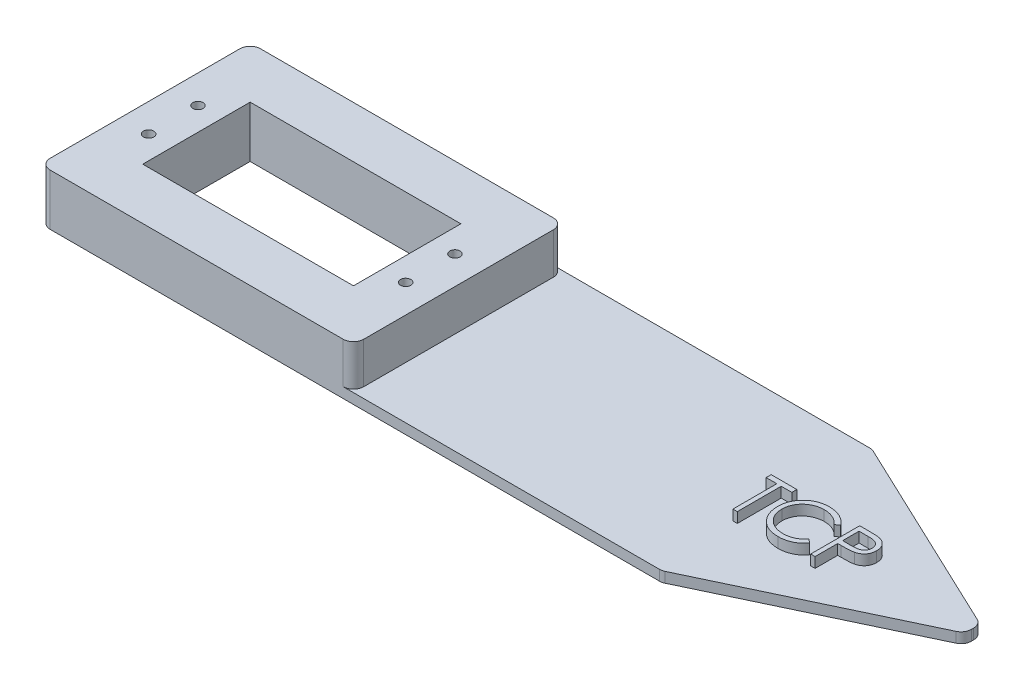
from build123d import *

# Parameters (mm, degrees)
SKETCH1_W           = 61
SKETCH1_H           = 40.9
SKETCH1_R           = 1
SKETCH1_W_2         = 41
SKETCH1_H_2         = 20.9
BOSS_EXTRUDE1_DEPTH = 10
SKETCH3_W           = 40.9
SKETCH3_H           = 2
BOSS_EXTRUDE2_DEPTH = 100
FILLET1_R           = 2
CUT_EXTRUDE1_REACH  = 134.335
FILLET2_R           = 2
BOSS_EXTRUDE3_DEPTH = 2


with BuildPart() as part:
    # Sketch1 → Boss-Extrude1 (new body)
    with BuildSketch(Plane(origin=(0, 0, 0), x_dir=(1, 0, 0), z_dir=(0, 1, 0))):
        Rectangle(SKETCH1_W, SKETCH1_H)
        with Locations(Location((25, 4.8, 0), (0, 0, 270))):
            Circle(SKETCH1_R, mode=Mode.SUBTRACT)
        with Locations(Location((-25, 4.8, 0), (0, 0, 90))):
            Circle(SKETCH1_R, mode=Mode.SUBTRACT)
        with Locations(Location((25, -4.8, 0), (0, 0, 90))):
            Circle(SKETCH1_R, mode=Mode.SUBTRACT)
        with Locations(Location((-25, -4.8, 0), (0, 0, 270))):
            Circle(SKETCH1_R, mode=Mode.SUBTRACT)
        Rectangle(SKETCH1_W_2, SKETCH1_H_2, mode=Mode.SUBTRACT)
    extrude(amount=BOSS_EXTRUDE1_DEPTH)

    # Sketch3 → Boss-Extrude2 (add)
    with BuildSketch(Plane(origin=(30.5, 0, 0), x_dir=(0, 0, -1), z_dir=(1, 0, 0))):
        with Locations((0, 1)):
            Rectangle(SKETCH3_W, SKETCH3_H)
    extrude(amount=BOSS_EXTRUDE2_DEPTH)

    # Fillet1
    fillet1_edges = [part.edges().sort_by_distance(p)[0] for p in [
        (30.5, 6, 20.45),
        (-30.5, 5, 20.45),
        (-30.5, 5, -20.45),
        (30.5, 6, -20.45),
    ]]
    fillet(fillet1_edges, radius=FILLET1_R)

    # Sketch4 → Cut-Extrude1 (cut, up to next)
    with BuildSketch(Plane(origin=(0, 2, 0), x_dir=(1, 0, 0), z_dir=(0, 1, 0)), mode=Mode.PRIVATE) as cut_extrude1_sk1:
        Polygon((130.5, -1.5), (90.5, -20.45), (130.5, -20.45), align=None)
    cut_extrude1_tool1 = extrude(cut_extrude1_sk1.sketch, amount=-CUT_EXTRUDE1_REACH, mode=Mode.PRIVATE) & part.part
    # Sketch4 → Cut-Extrude1 (cut, up to next)
    with BuildSketch(Plane(origin=(0, 2, 0), x_dir=(1, 0, 0), z_dir=(0, 1, 0)), mode=Mode.PRIVATE) as cut_extrude1_sk2:
        Polygon((130.5, 20.45), (130.5, 1.5), (90.5, 20.45), align=None)
    cut_extrude1_tool2 = extrude(cut_extrude1_sk2.sketch, amount=-CUT_EXTRUDE1_REACH, mode=Mode.PRIVATE) & part.part
    add(cut_extrude1_tool1.solids().sort_by_distance((117.166667, 2, 14.133333))[0], mode=Mode.SUBTRACT)
    add(cut_extrude1_tool2.solids().sort_by_distance((117.166667, 2, -14.133333))[0], mode=Mode.SUBTRACT)

    # Fillet2
    fillet2_edges = [part.edges().sort_by_distance(p)[0] for p in [
        (130.5, 1, 1.5),
        (90.5, 1, 20.45),
        (90.5, 1, -20.45),
        (130.5, 1, -1.5),
    ]]
    fillet(fillet2_edges, radius=FILLET2_R)

    # Sketch5 → Boss-Extrude3 (add)
    # profile 1 of 3: a face of its own
    with BuildSketch(Plane(origin=(0, 2, 0), x_dir=(1, 0, 0), z_dir=(0, 1, 0))):
        Polygon((86.952754006, 3.391795513), (86.952754006, 4.36871859), (91.959484775, 4.36871859), (91.959484775, 3.391795513), (89.883523236, 3.391795513), (89.883523236, -5.15628141), (89.028715544, -5.15628141), (89.028715544, 3.391795513), align=None)
    # profile 2 of 3: a face of its own
    with BuildSketch(Plane(origin=(0, 2, 0), x_dir=(1, 0, 0), z_dir=(0, 1, 0))):
        with BuildLine():
            Line((102.217177083, 2.620942148), (101.469220352, 2.048526282))
            add(Edge.make_bspline(
                [(101.469220352, 2.048526282), (101.415864327, 2.1121151), (101.309871632, 2.238435421), (101.139349088, 2.415816896), (100.961635332, 2.582001643), (100.776798295, 2.737781329), (100.581510977, 2.877708385), (100.380504089, 3.009074744), (100.170415123, 3.126824802), (99.879897902, 3.269599071), (99.499856258, 3.418586822), (99.02144316, 3.543509187), (98.522030814, 3.623032529), (98.181314489, 3.631645419), (98.008012419, 3.636026282)],
                knots=[0, 0, 0, 0, 0.757959112, 1.505699292, 2.245454638, 2.979532153, 3.711538275, 4.438200793, 5.171680507, 5.909471876, 7.393775596, 8.890124382, 10.418191784, 12, 12, 12, 12], degree=3))
            add(Edge.make_bspline(
                [(98.008012419, 3.636026282), (97.912535726, 3.634926927), (97.722468453, 3.63273842), (97.440396536, 3.603866444), (97.163591733, 3.563286651), (96.8922341, 3.503074164), (96.626669048, 3.426948679), (96.36516044, 3.335983803), (96.11149445, 3.22343956), (95.862161959, 3.099047795), (95.623277106, 2.958547392), (95.397248726, 2.805294627), (95.184901185, 2.641004443), (94.986066505, 2.465061075), (94.800541417, 2.278256883), (94.629670235, 2.078601068), (94.474044226, 1.866731938), (94.330578608, 1.645443308), (94.202092526, 1.415379746), (94.094514783, 1.175689733), (93.999250843, 0.930477853), (93.923869333, 0.676973622), (93.864203326, 0.416960809), (93.823034471, 0.149741594), (93.794490846, -0.124125777), (93.792313222, -0.309752549), (93.791215544, -0.403321674)],
                knots=[0, 0, 0, 0, 1.054917814, 2.100044995, 3.131103042, 4.146048494, 5.169673617, 6.183595914, 7.203665975, 8.234915748, 9.262203917, 10.264457458, 11.251630812, 12.227803204, 13.197192746, 14.159520551, 15.12972552, 16.100847026, 17.073214652, 18.039054194, 19.002613845, 19.979014051, 20.95965708, 21.949030935, 22.966165397, 24, 24, 24, 24], degree=3))
            add(Edge.make_bspline(
                [(93.791215544, -0.403321674), (93.794649494, -0.544104766), (93.8013916, -0.820513694), (93.861394567, -1.225382284), (93.952576279, -1.613242117), (94.089234385, -1.981668688), (94.257742659, -2.335205006), (94.470668894, -2.667869314), (94.717275328, -2.984688679), (95.001050712, -3.278175558), (95.312397969, -3.546273625), (95.646447642, -3.782359136), (96.00236774, -3.979158923), (96.376228426, -4.142923463), (96.770906636, -4.268807843), (97.185692634, -4.357428779), (97.619684279, -4.415237857), (97.916236717, -4.420772393), (98.067162058, -4.423589102)],
                knots=[0, 0, 0, 0, 1.029171465, 2.020641659, 2.987623507, 3.938342917, 4.889210282, 5.84687017, 6.821220943, 7.821438502, 8.827599549, 9.822697543, 10.807740252, 11.797342354, 12.80366471, 13.83203677, 14.896651826, 16, 16, 16, 16], degree=3))
            add(Edge.make_bspline(
                [(98.067162058, -4.423589102), (98.233448662, -4.418993209), (98.560740477, -4.409947391), (99.040713463, -4.333314006), (99.50018794, -4.209059244), (99.939188621, -4.035165612), (100.356477909, -3.809109364), (100.75270882, -3.535067284), (101.128215808, -3.210432607), (101.354016226, -2.962556379), (101.469220352, -2.836089102)],
                knots=[0, 0, 0, 0, 1.028121516, 2.023589091, 2.998037872, 3.967518031, 4.937445131, 5.927275754, 6.942489185, 8, 8, 8, 8], degree=3))
            Line((101.469220352, -2.836089102), (102.217177083, -3.402780809))
            add(Edge.make_bspline(
                [(102.217177083, -3.402780809), (102.156984226, -3.480446167), (102.036886834, -3.635404872), (101.842418945, -3.853858596), (101.637557157, -4.059337435), (101.420779832, -4.250184747), (101.194580699, -4.4302194), (100.954898192, -4.594326527), (100.704883182, -4.744796719), (100.445382779, -4.882574278), (100.176672697, -5.004813357), (99.899074913, -5.10946254), (99.61378599, -5.19960956), (99.320792885, -5.27377376), (99.019487861, -5.331661495), (98.710958214, -5.370359324), (98.394538053, -5.396871249), (98.181065329, -5.399287648), (98.072886217, -5.400512179)],
                knots=[0, 0, 0, 0, 0.986787822, 1.968848986, 2.935600012, 3.899624008, 4.868462664, 5.837806735, 6.815139263, 7.798259679, 8.787526145, 9.778297419, 10.776456485, 11.791383307, 12.812564526, 13.85620153, 14.913611965, 16, 16, 16, 16], degree=3))
            add(Edge.make_bspline(
                [(98.072886217, -5.400512179), (97.970441666, -5.399799185), (97.767870252, -5.398389328), (97.46878865, -5.375550643), (97.177624148, -5.344391002), (96.895208916, -5.297473217), (96.620001798, -5.242107549), (96.354497636, -5.167890772), (96.096083813, -5.084753397), (95.845798543, -4.98704054), (95.603428932, -4.876778643), (95.369756702, -4.752160187), (95.144889326, -4.614233112), (94.926616002, -4.466037691), (94.718161149, -4.302813748), (94.517718341, -4.126828121), (94.324163602, -3.938673963), (94.204413438, -3.802997541), (94.144205328, -3.734782011)],
                knots=[0, 0, 0, 0, 1.114604814, 2.203992996, 3.262667896, 4.300477797, 5.318619304, 6.316056647, 7.298880507, 8.271930387, 9.238335007, 10.195173496, 11.151986948, 12.108099108, 13.064862484, 14.031167946, 15.010108607, 16, 16, 16, 16], degree=3))
            add(Edge.make_bspline(
                [(94.144205328, -3.734782011), (94.047769755, -3.616287775), (93.856062865, -3.38072987), (93.610792254, -2.998951593), (93.400840693, -2.600348824), (93.23108908, -2.182827447), (93.098384785, -1.747324343), (93.006451676, -1.293619979), (92.946711952, -0.822138079), (92.93988038, -0.501453676), (92.936407852, -0.338447876)],
                knots=[0, 0, 0, 0, 0.994628077, 1.977248131, 2.950237994, 3.925870899, 4.908910175, 5.911660606, 6.938484602, 8, 8, 8, 8], degree=3))
            add(Edge.make_bspline(
                [(92.936407852, -0.338447876), (92.9406402, -0.167119106), (92.948967081, 0.169959553), (93.019712781, 0.664644383), (93.133519648, 1.138584975), (93.295164038, 1.590896595), (93.500102172, 2.023958286), (93.753267457, 2.43446185), (94.051718751, 2.82503257), (94.393115346, 3.189744143), (94.767495023, 3.523226238), (95.168412652, 3.816613121), (95.595083522, 4.060772932), (96.042807104, 4.264869632), (96.514935995, 4.421744921), (97.010462878, 4.531563236), (97.528456639, 4.599917674), (97.881867954, 4.608558775), (98.0614379, 4.612949359)],
                knots=[0, 0, 0, 0, 1.032925535, 2.032216505, 3.007276963, 3.968222605, 4.92396291, 5.891752235, 6.871517503, 7.883894988, 8.900124299, 9.891468569, 10.874487609, 11.85992873, 12.854644235, 13.869047385, 14.917252991, 16, 16, 16, 16], degree=3))
            add(Edge.make_bspline(
                [(98.0614379, 4.612949359), (98.170878713, 4.611637255), (98.38750578, 4.609040076), (98.707961213, 4.583714075), (99.019952117, 4.541494903), (99.323693432, 4.484029028), (99.620662838, 4.412707674), (99.908590636, 4.319797291), (100.189166348, 4.213562159), (100.460620434, 4.091210906), (100.721650474, 3.953869274), (100.97217517, 3.803059612), (101.210204535, 3.638968885), (101.437413473, 3.462992672), (101.650001161, 3.271408021), (101.854003471, 3.069484563), (102.042492548, 2.851406085), (102.158842314, 2.697904086), (102.217177083, 2.620942148)],
                knots=[0, 0, 0, 0, 1.096760587, 2.17092713, 3.219439832, 4.250915756, 5.268269357, 6.278326846, 7.281116186, 8.274029601, 9.260640565, 10.235837813, 11.203064059, 12.156899882, 13.114053108, 14.069676657, 15.032185724, 16, 16, 16, 16], degree=3))
        make_face()
    # profile 3 of 3: a face of its own
    with BuildSketch(Plane(origin=(0, 2, 0), x_dir=(1, 0, 0), z_dir=(0, 1, 0))):
        with BuildLine():
            Line((104.171023236, 4.36871859), (106.03900701, 4.36871859))
            add(Edge.make_bspline(
                [(106.03900701, 4.36871859), (106.167488119, 4.368577358), (106.41366363, 4.368306752), (106.766673888, 4.360102336), (107.087284658, 4.349143981), (107.374804623, 4.333953258), (107.630118433, 4.316001109), (107.852070798, 4.290822344), (108.042406305, 4.26453254), (108.156451714, 4.237804284), (108.20846314, 4.225614624)],
                knots=[0, 0, 0, 0, 1.415646017, 2.712440637, 3.8905458, 4.950247383, 5.884950622, 6.709939814, 7.411656543, 8, 8, 8, 8], degree=3))
            add(Edge.make_bspline(
                [(108.20846314, 4.225614624), (108.274304114, 4.20759346), (108.404434602, 4.17197578), (108.59194387, 4.100637004), (108.770343978, 4.016049111), (108.940247005, 3.919645389), (109.099565102, 3.807289675), (109.250675256, 3.683536473), (109.392243917, 3.545528561), (109.523474991, 3.394813833), (109.643992904, 3.233922405), (109.747760112, 3.060452479), (109.83464778, 2.877324004), (109.909169397, 2.684664356), (109.962804548, 2.48085569), (110.003209325, 2.267314137), (110.028855055, 2.044062588), (110.031311312, 1.891499662), (110.032561698, 1.813835778)],
                knots=[0, 0, 0, 0, 0.999701418, 1.975846123, 2.934577507, 3.890451536, 4.834027766, 5.787354733, 6.749476667, 7.726910423, 8.712836071, 9.690891519, 10.682875813, 11.679750201, 12.712814741, 13.765529915, 14.8625177, 16, 16, 16, 16], degree=3))
            add(Edge.make_bspline(
                [(110.032561698, 1.813835778), (110.031414821, 1.735519114), (110.029170878, 1.582287271), (110.002238844, 1.358115612), (109.96596168, 1.143889136), (109.910180416, 0.940082846), (109.837121834, 0.74790707), (109.751418462, 0.564425003), (109.648048997, 0.392758182), (109.52927271, 0.232283383), (109.397143014, 0.082849979), (109.252218947, -0.05445914), (109.095085586, -0.178840233), (108.926242312, -0.290572139), (108.744043081, -0.387063871), (108.55125122, -0.473489108), (108.346190988, -0.546072495), (108.204288861, -0.584254305), (108.132141025, -0.603667227)],
                knots=[0, 0, 0, 0, 1.121902311, 2.195077645, 3.232258892, 4.234102512, 5.217864754, 6.176164875, 7.132989551, 8.084763148, 9.034132444, 9.988522005, 10.94243251, 11.903244335, 12.886203696, 13.894208494, 14.929344452, 16, 16, 16, 16], degree=3))
            add(Edge.make_bspline(
                [(108.132141025, -0.603667227), (108.072467352, -0.616357197), (107.941689027, -0.644168004), (107.726307762, -0.675215304), (107.475540676, -0.701715489), (107.189730043, -0.721585014), (106.869132408, -0.738594945), (106.513574344, -0.752115258), (106.122357891, -0.75954436), (105.849476862, -0.759927517), (105.707005808, -0.760127564)],
                knots=[0, 0, 0, 0, 0.601384939, 1.31797006, 2.144135048, 3.087295005, 4.142315834, 5.309527816, 6.595305764, 8, 8, 8, 8], degree=3))
            Line((105.707005808, -0.760127564), (105.025830929, -0.760127564))
            Line((105.025830929, -0.760127564), (105.025830929, -5.15628141))
            Line((105.025830929, -5.15628141), (104.171023236, -5.15628141))
            Line((104.171023236, -5.15628141), (104.171023236, 4.36871859))
        make_face()
        with BuildLine():
            Line((105.025830929, 3.391795513), (105.025830929, 0.216795513))
            Line((105.025830929, 0.216795513), (106.69346915, 0.195806932))
            add(Edge.make_bspline(
                [(106.69346915, 0.195806932), (106.774894091, 0.195764848), (106.932083261, 0.195683608), (107.159148982, 0.206529109), (107.369812829, 0.21904913), (107.563427709, 0.237380465), (107.740080902, 0.263291887), (107.900066963, 0.289449545), (108.042145354, 0.327291996), (108.208422467, 0.378245491), (108.393706434, 0.465147824), (108.595275977, 0.591285739), (108.766101644, 0.752069666), (108.913925009, 0.932848264), (109.031234577, 1.133959467), (109.117111956, 1.34913993), (109.167570391, 1.576182864), (109.17433639, 1.731544156), (109.177754006, 1.810019672)],
                knots=[0, 0, 0, 0, 1.160613943, 2.240541288, 3.23993089, 4.169200891, 5.011653406, 5.7853311, 6.478053781, 7.106038997, 8.262395093, 9.384106736, 10.481365981, 11.59014053, 12.70357646, 13.786202915, 14.881775077, 16, 16, 16, 16], degree=3))
            add(Edge.make_bspline(
                [(109.177754006, 1.810019672), (109.174317803, 1.886596626), (109.167487059, 2.038822134), (109.11671646, 2.261921476), (109.031401541, 2.474834357), (108.913137523, 2.673425396), (108.769606305, 2.853553498), (108.602784521, 3.010027823), (108.41306486, 3.135816885), (108.236585032, 3.21700603), (108.079827518, 3.266577601), (107.943669113, 3.301261774), (107.789933777, 3.32895396), (107.618571463, 3.351377178), (107.430910365, 3.370572669), (107.225338237, 3.383597364), (107.002633822, 3.391221327), (106.848027911, 3.391599484), (106.767883212, 3.391795513)],
                knots=[0, 0, 0, 0, 1.120700087, 2.227813068, 3.331159281, 4.466773991, 5.599788987, 6.693661531, 7.80175334, 8.91857717, 9.525282508, 10.207424825, 10.974604443, 11.810962634, 12.737642355, 13.736264703, 14.826523623, 16, 16, 16, 16], degree=3))
            Line((106.767883212, 3.391795513), (105.025830929, 3.391795513))
        make_face(mode=Mode.SUBTRACT)
    extrude(amount=BOSS_EXTRUDE3_DEPTH)


solid = part.part
